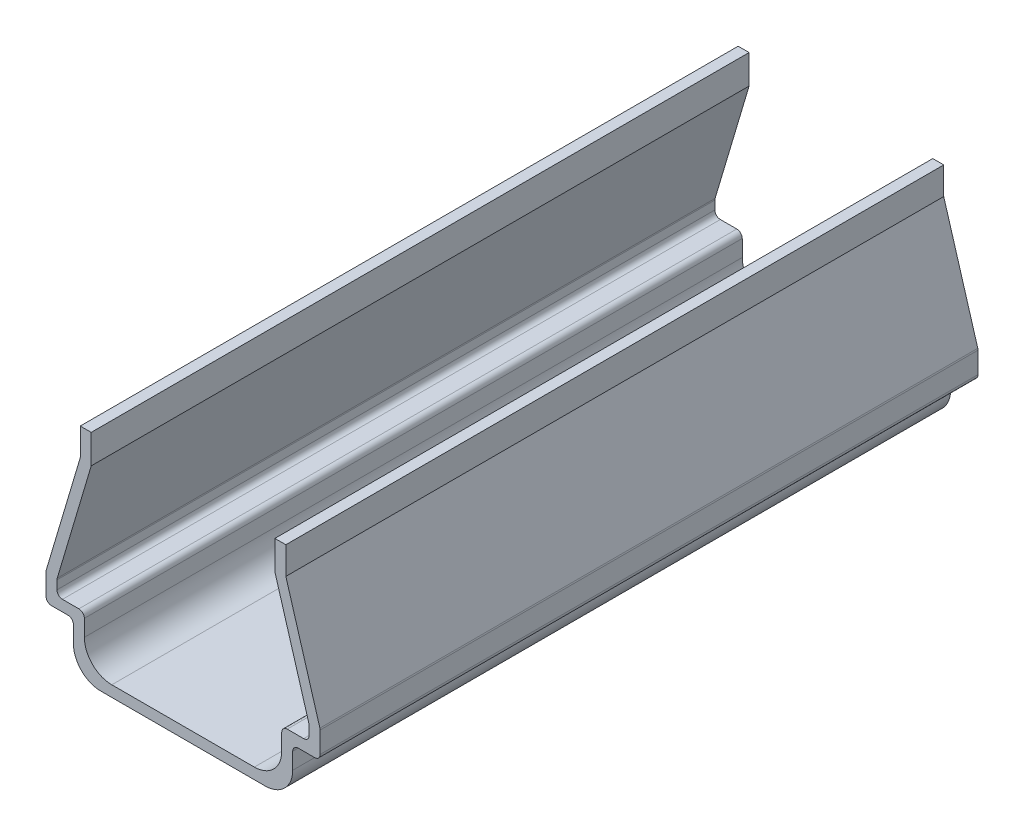
from build123d import *

# Parameters (mm, degrees)
EXTRUDE_THIN1_DEPTH = 24
FILLET1_R           = 1
FILLET2_R           = 0.2


with BuildPart() as part:
    # Sketch1 → Extrude-Thin1 (new body)
    with BuildSketch(Plane.XY):
        Polygon((3.75, 8), (3.75, 7), (5, 2.8), (5, 1.8), (4, 1.8), (4, 0), (-4, 0), (-4, 1.8), (-5, 1.8), (-5, 2.8), (-3.75, 7), (-3.75, 8), (-3.35, 8), (-3.35, 6.941738969), (-4.6, 2.741738969), (-4.6, 2.2), (-3.6, 2.2), (-3.6, 0.4), (3.6, 0.4), (3.6, 2.2), (4.6, 2.2), (4.6, 2.741738969), (3.35, 6.941738969), (3.35, 8), align=None)
    extrude(amount=EXTRUDE_THIN1_DEPTH)

    # Fillet1
    fillet1_edges = [part.edges().sort_by_distance(p)[0] for p in [
        (4, 0, 12),
        (-4, 0, 12),
        (-3.6, 0.4, 12),
        (3.6, 0.4, 12),
    ]]
    fillet(fillet1_edges, radius=FILLET1_R)

    # Fillet2
    fillet2_edges = [part.edges().sort_by_distance(p)[0] for p in [
        (5, 2.8, 12),
        (5, 1.8, 12),
        (4, 1.8, 12),
        (-4, 1.8, 12),
        (-5, 1.8, 12),
        (-5, 2.8, 12),
        (-4.6, 2.741738969, 12),
        (-4.6, 2.2, 12),
        (-3.6, 2.2, 12),
        (3.6, 2.2, 12),
        (4.6, 2.2, 12),
        (4.6, 2.741738969, 12),
    ]]
    fillet(fillet2_edges, radius=FILLET2_R)


solid = part.part
